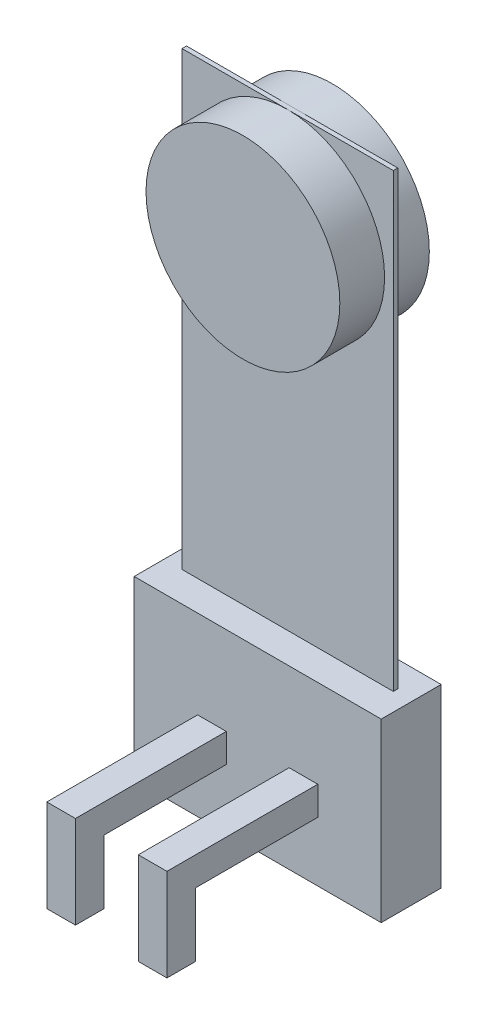
from build123d import *

# Parameters (mm, degrees)
SKETCH1_W                = 5.9944
SKETCH1_H                = 12.8016
BOSS_EXTRUDE1_DEPTH      = 0.127
BOSS_EXTRUDE2_DEPTH      = 0.8509
BOSS_EXTRUDE2_DEPTH_BACK = 0.8509
SKETCH2_W                = 7.0104
SKETCH2_H                = 5.0038
BOSS_EXTRUDE3_DEPTH      = 1.27
BOSS_EXTRUDE3_DEPTH_BACK = 1.27
SKETCH3_R                = 2.75
BOSS_EXTRUDE4_DEPTH      = 7.0104
SKETCH5_W                = 1.800661627
SKETCH5_H                = 4.2799
SKETCH5_W_2              = 1.783476746
CUT_EXTRUDE1_DEPTH       = 7.0104


with BuildPart() as part:
    # Sketch1 → Boss-Extrude1 (new body)
    with BuildSketch(Plane.XY):
        with Locations((2.9972, 6.4008)):
            Rectangle(SKETCH1_W, SKETCH1_H)
    extrude(amount=BOSS_EXTRUDE1_DEPTH)

    # Sketch2 → Boss-Extrude2 (add, two sides: drawn at the far end of the back side and taken through both)
    with BuildSketch(Plane.XY.offset(0.127).offset(-BOSS_EXTRUDE2_DEPTH_BACK)):
        with Locations((2.9972, -2.5019)):
            Rectangle(SKETCH2_W, SKETCH2_H)
    extrude(amount=BOSS_EXTRUDE2_DEPTH + BOSS_EXTRUDE2_DEPTH_BACK)

    # Sketch3 → Boss-Extrude3 (add, two sides: drawn at the far end of the back side and taken through both)
    with BuildSketch(Plane.XY.offset(0.127).offset(-BOSS_EXTRUDE3_DEPTH_BACK)):
        with Locations((2.9972, 10.0516)):
            Circle(SKETCH3_R)
    extrude(amount=BOSS_EXTRUDE3_DEPTH + BOSS_EXTRUDE3_DEPTH_BACK)

    # Sketch4 → Boss-Extrude4 (add)
    with BuildSketch(Plane.ZY.offset(0.508)):
        Polygon((0.9779, -3.3147), (4.445, -3.3147), (4.445, -5.123816362), (5.2578, -5.123816362), (5.2578, -2.5019), (0.9779, -2.5019), align=None)
    extrude(amount=-BOSS_EXTRUDE4_DEPTH)

    # Sketch5 → Cut-Extrude1 (cut)
    with BuildSketch(Plane(origin=(0, -2.5019, 0), x_dir=(1, 0, 0), z_dir=(0, 1, 0))):
        with Locations((0.392330813, -3.11785)):
            Rectangle(SKETCH5_W, SKETCH5_H)
        with Locations((2.9972, -3.11785)):
            Rectangle(SKETCH5_W_2, SKETCH5_H)
        with Locations((5.602069187, -3.11785)):
            Rectangle(SKETCH5_W, SKETCH5_H)
    extrude(amount=-CUT_EXTRUDE1_DEPTH, mode=Mode.SUBTRACT)


solid = part.part
